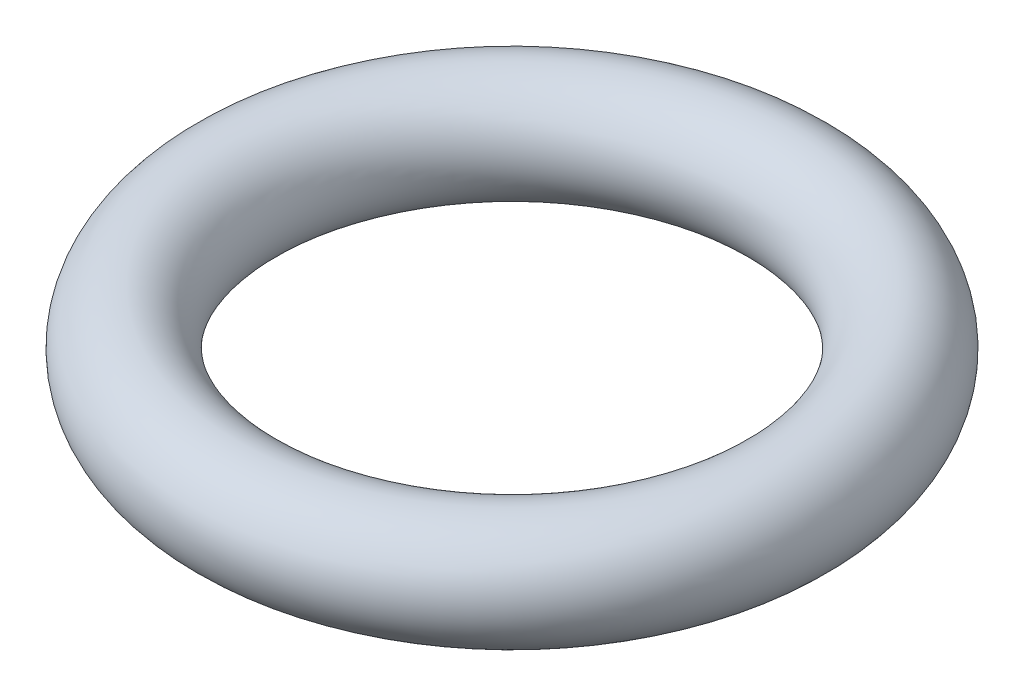
from build123d import *

# Parameters (mm, degrees)
CROQUIS1_R = 1


with BuildPart() as part:
    # Croquis1 → Revolución1 (revolve)
    with BuildSketch(Plane.XY, mode=Mode.PRIVATE) as revoluci_n1_sk:
        with Locations((5, 0)):
            Circle(CROQUIS1_R)
    revolve(revoluci_n1_sk.sketch.rotate(Axis((0, 0, 0), (0, -1, 0)), 90), axis=Axis((0, 0, 0), (0, -1, 0)))


solid = part.part
